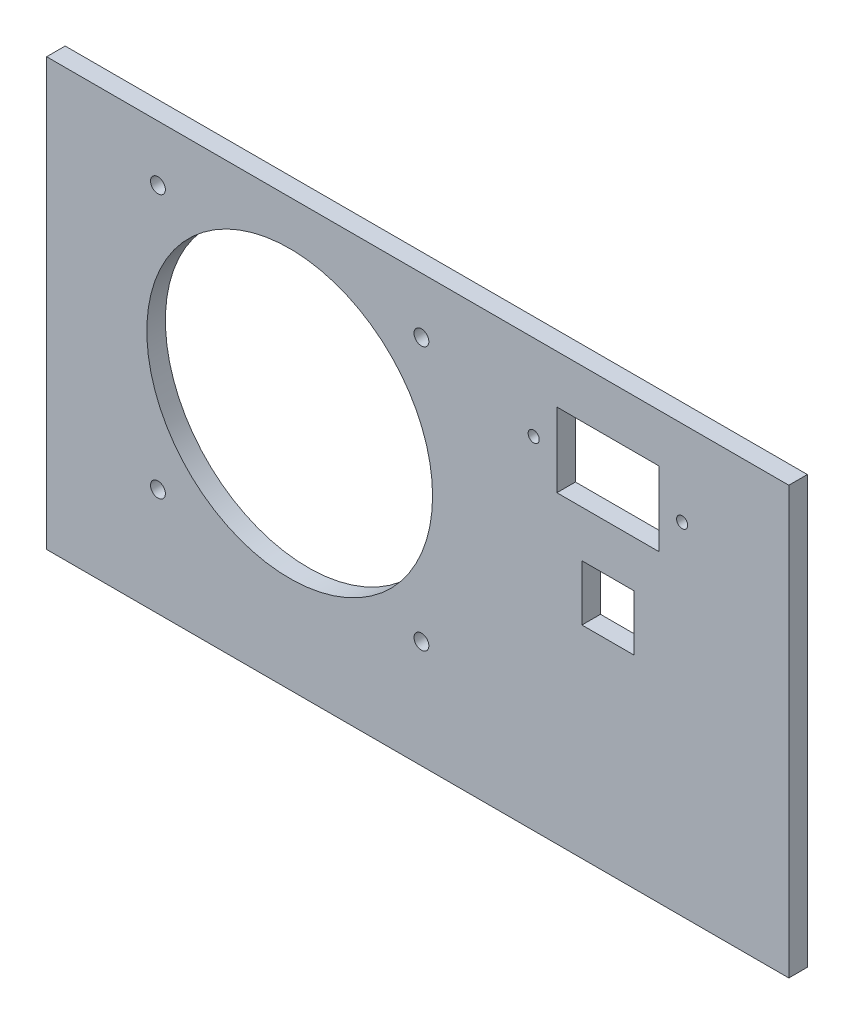
from build123d import *

# Parameters (mm, degrees)
SKETCH1_W           = 200
SKETCH1_H           = 115
SKETCH1_R           = 38.5
SKETCH1_R_2         = 2
SKETCH1_R_3         = 1.5
SKETCH1_W_2         = 27.5
SKETCH1_H_2         = 20
SKETCH1_W_3         = 14
SKETCH1_H_3         = 15
BOSS_EXTRUDE1_DEPTH = 5


with BuildPart() as part:
    # Sketch1 → Boss-Extrude1 (new body)
    with BuildSketch(Plane.XY):
        Rectangle(SKETCH1_W, SKETCH1_H)
        with Locations((-34.5, 7)):
            Circle(SKETCH1_R, mode=Mode.SUBTRACT)
        with Locations((-70, 42.5)):
            Circle(SKETCH1_R_2, mode=Mode.SUBTRACT)
        with Locations((1, 42.5)):
            Circle(SKETCH1_R_2, mode=Mode.SUBTRACT)
        with Locations((1, -28.5)):
            Circle(SKETCH1_R_2, mode=Mode.SUBTRACT)
        with Locations((-70, -28.5)):
            Circle(SKETCH1_R_2, mode=Mode.SUBTRACT)
        with Locations((71.25, 34.5)):
            Circle(SKETCH1_R_3, mode=Mode.SUBTRACT)
        with Locations(Location((31.25, 34.5, 0), (0, 0, 180))):
            Circle(SKETCH1_R_3, mode=Mode.SUBTRACT)
        with Locations((51.25, 34.5)):
            Rectangle(SKETCH1_W_2, SKETCH1_H_2, mode=Mode.SUBTRACT)
        with Locations((51.25, 4.5)):
            Rectangle(SKETCH1_W_3, SKETCH1_H_3, mode=Mode.SUBTRACT)
    extrude(amount=BOSS_EXTRUDE1_DEPTH)


solid = part.part
